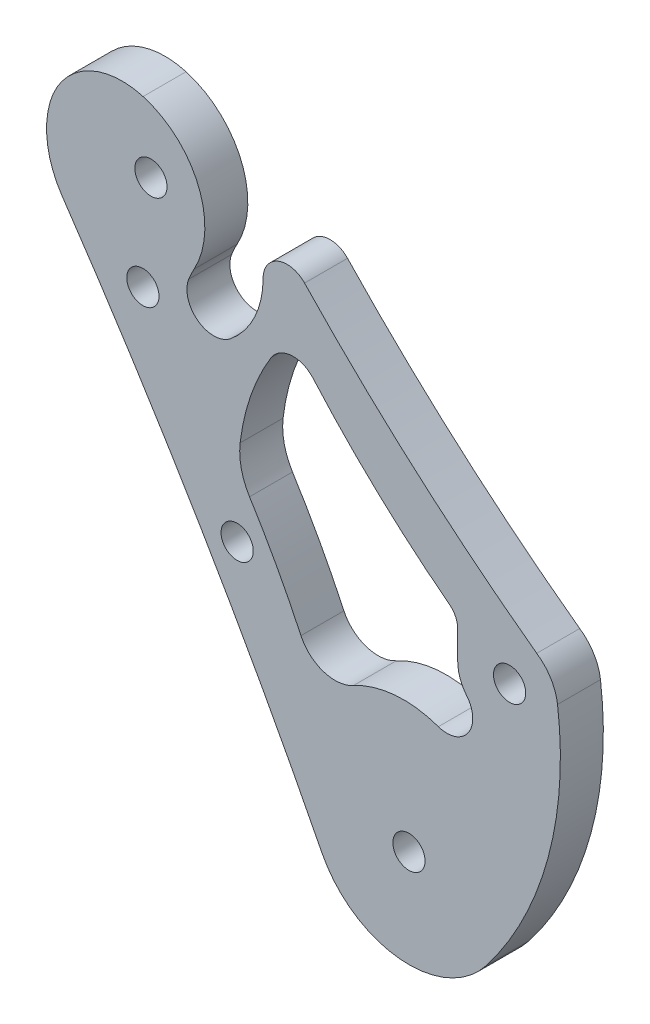
from build123d import *

# Parameters (mm, degrees)
ESQUISSE1_R             = 1.5
ESQUISSE1_R_2           = 1.50110642
BOSS_EXTRU_1_DEPTH      = 4
ENL_V_MAT_EXTRU_1_REACH = 125.223
ESQUISSE2_R             = 1.5


with BuildPart() as part:
    # Esquisse1 → Boss.-Extru.1 (new body)
    with BuildSketch(Plane.XY):
        with BuildLine():
            ThreePointArc((60.026944648, 49.921558504), (72.778337749, 29.898863696), (84.195273994, 9.086369847))
            ThreePointArc((84.195273994, 9.086369847), (91.451273571, 4.140927091), (99.509067829, 7.630753106))
            ThreePointArc((99.509067829, 7.630753106), (105.251720368, 19.156706799), (106.145904128, 32.002955361))
            ThreePointArc((106.145904128, 32.002955361), (105.517176975, 33.787686969), (104.210334733, 35.15616353))
            ThreePointArc((104.210334733, 35.15616353), (92.971958662, 44.192993768), (82.590078147, 54.202087354))
            ThreePointArc((82.590078147, 54.202087354), (80.137934282, 54.740727896), (78.729966346, 52.662081831))
            ThreePointArc((78.729966346, 52.662081831), (77.941811074, 49.138614128), (75.724895458, 46.288824918))
            ThreePointArc((75.724895458, 46.288824918), (72.669831469, 46.192839127), (71.805280587, 49.124593043))
            ThreePointArc((71.805280587, 49.124593043), (72.037430034, 49.666429843), (72.305683245, 50.1913305))
            ThreePointArc((72.305683245, 50.1913305), (72.705414889, 57.102347775), (67.554070479, 61.726804061))
            ThreePointArc((67.554070479, 61.726804061), (62.230705401, 61.135851095), (58.891944342, 56.947758957))
            ThreePointArc((58.891944342, 56.947758957), (58.674610839, 53.307878055), (60.026944648, 49.921558504))
        make_face()
        with Locations((68.285467108, 55.560427953)):
            Circle(ESQUISSE1_R, mode=Mode.SUBTRACT)
        with Locations((101.682075096, 31.433543054)):
            Circle(ESQUISSE1_R, mode=Mode.SUBTRACT)
        with Locations((92.312371453, 13.200094295)):
            Circle(ESQUISSE1_R, mode=Mode.SUBTRACT)
        with Locations((67.535467108, 46.360427953)):
            Circle(ESQUISSE1_R_2, mode=Mode.SUBTRACT)
        with BuildLine():
            Line((96.849719723, 30.848999233), (96.849719723, 33.474650871))
            ThreePointArc((96.849719723, 33.474650871), (96.647309876, 34.343108764), (96.081794601, 35.032587793))
            ThreePointArc((96.081794601, 35.032587793), (89.436975045, 40.671042336), (83.372922141, 46.929880801))
            ThreePointArc((83.372922141, 46.929880801), (81.323140328, 47.752609653), (79.445810973, 46.588941858))
            ThreePointArc((79.445810973, 46.588941858), (77.571604785, 42.607109512), (76.591708968, 38.316720036))
            ThreePointArc((76.591708968, 38.316720036), (76.69683067, 36.288635677), (77.467153905, 34.409598995))
            ThreePointArc((77.467153905, 34.409598995), (79.992055499, 30.078906011), (82.254048976, 25.605270433))
            ThreePointArc((82.254048976, 25.605270433), (84.350090923, 23.753861276), (87.134236378, 24.017758597))
            ThreePointArc((87.134236378, 24.017758597), (91.023623533, 25.188476532), (95.051173024, 24.662398573))
            ThreePointArc((95.051173024, 24.662398573), (97.816197879, 25.543673578), (97.709238653, 28.443771474))
            ThreePointArc((97.709238653, 28.443771474), (97.07105369, 29.571903567), (96.849719723, 30.848999233))
        make_face(mode=Mode.SUBTRACT)
    extrude(amount=BOSS_EXTRU_1_DEPTH)

    # Esquisse2 → Enlèv. mat.-Extru.1 (cut, up to next)
    with BuildSketch(Plane.XY.offset(4), mode=Mode.PRIVATE) as enl_v_mat_extru_1_sk1:
        with Locations((76.312371453, 30.200094295)):
            Circle(ESQUISSE2_R)
    enl_v_mat_extru_1_tool1 = extrude(enl_v_mat_extru_1_sk1.sketch, amount=-ENL_V_MAT_EXTRU_1_REACH, mode=Mode.PRIVATE) & part.part
    add(enl_v_mat_extru_1_tool1.solids().sort_by_distance((76.312371, 30.200094, 4))[0], mode=Mode.SUBTRACT)


solid = part.part
